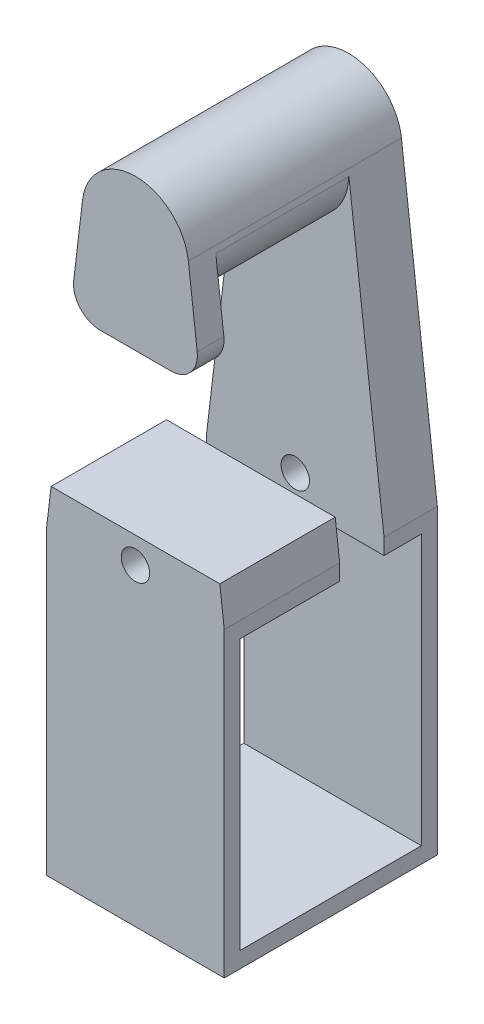
from build123d import *

# Parameters (mm, degrees)
EXTRUDE_1_DEPTH     = 24
CUT_EXTRUDE_1_DEPTH = 80.586658306
SKETCH_3_R          = 1.6
CUT_EXTRUDE_2_DEPTH = 80.586658306
CUT_EXTRUDE_3_DEPTH = 15
FILLET_1_R          = 3


with BuildPart() as part:
    # 草图1 → 凸台-拉伸1 (new body)
    with BuildSketch(Plane.XY):
        with BuildLine():
            Line((0, 0), (20, 0))
            Line((20, 0), (20, 34))
            Line((20, 34), (15.957817839, 67.908823654))
            ThreePointArc((15.957817839, 67.908823654), (10, 73.198607775), (4.042182161, 67.908823654))
            Line((4.042182161, 67.908823654), (0, 34))
            Line((0, 34), (0, 0))
        make_face()
    extrude(amount=EXTRUDE_1_DEPTH)

    # 草图2 → 切除-拉伸1 (cut, through all)
    with BuildSketch(Plane(origin=(20, 0, 0), x_dir=(0, 0, -1), z_dir=(1, 0, 0))):
        Polygon((-22.2, 32.2), (-11, 32.2), (-11, 38.2), (-24, 38.2), (-24, 56.198607775), (-21, 56.198607775), (-21, 61.198607775), (-6, 61.198607775), (-6, 38.2), (-6, 32.2), (-1.8, 32.2), (-1.8, 1.8), (-22.2, 1.8), align=None)
    extrude(amount=-CUT_EXTRUDE_1_DEPTH, mode=Mode.SUBTRACT)

    # 草图3 → 切除-拉伸2 (cut, through all)
    with BuildSketch(Plane.XY.offset(24)):
        with Locations((10, 35.269565603)):
            Circle(SKETCH_3_R)
    extrude(amount=-CUT_EXTRUDE_2_DEPTH, mode=Mode.SUBTRACT)

    # 草图4 → 切除-拉伸3 (cut)
    with BuildSketch(Plane.XY.offset(6)):
        with BuildLine():
            Line((16, 67.198607775), (19.499328987, 67.198607775))
            Line((19.499328987, 67.198607775), (19.499328987, 38.2))
            Line((19.499328987, 38.2), (0.500671013, 38.2))
            Line((0.500671013, 38.2), (0.500671013, 67.198607775))
            Line((0.500671013, 67.198607775), (4, 67.198607775))
            ThreePointArc((4, 67.198607775), (10, 61.198607775), (16, 67.198607775))
        make_face()
    extrude(amount=CUT_EXTRUDE_3_DEPTH, mode=Mode.SUBTRACT)

    # 圆角1
    fillet_1_edges = [part.edges().sort_by_distance(p)[0] for p in [
        (17.35376204, 56.198607775, 22.5),
        (2.64623796, 56.198607775, 22.5),
    ]]
    fillet(fillet_1_edges, radius=FILLET_1_R)


solid = part.part
